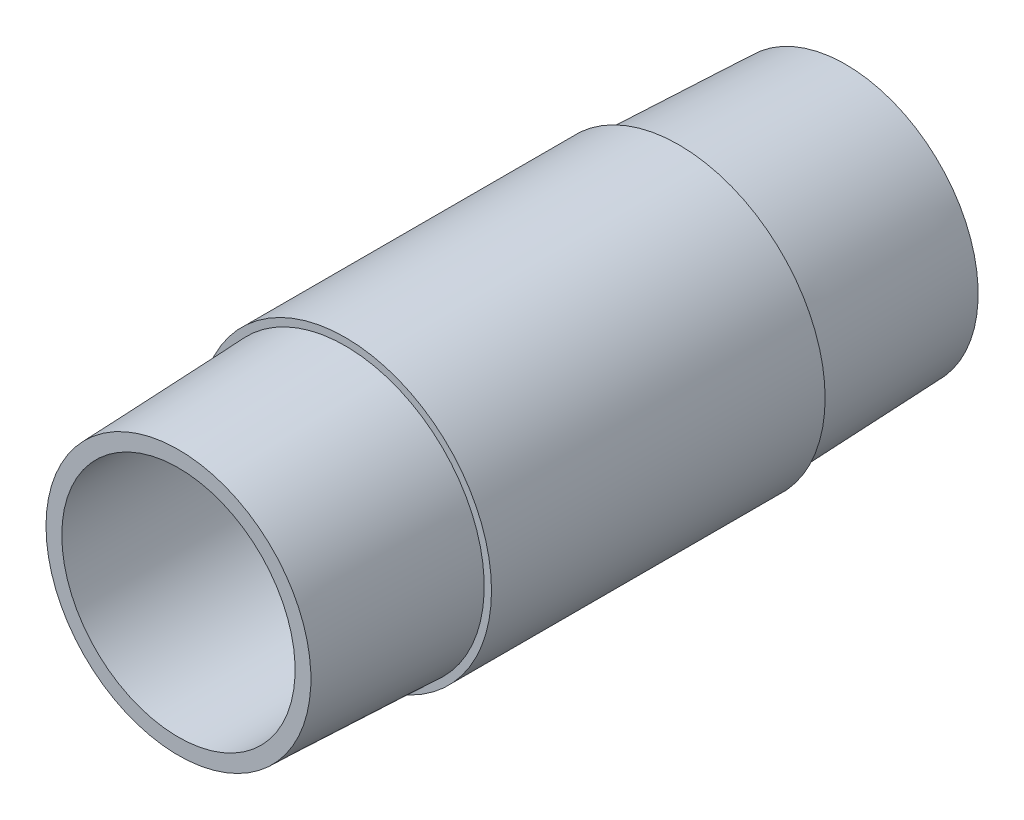
from build123d import *

# Parameters (mm, degrees)
SKETCH2_R           = 16.7005
SKETCH2_R_2         = 13.3223
BOSS_EXTRUDE1_DEPTH = 76.2


with BuildPart() as part:
    # Sketch2 → Boss-Extrude1 (new body)
    with BuildSketch(Plane.XY):
        with Locations(Location((0, 0, 0), (0, 0, 180))):
            Circle(SKETCH2_R)
        with Locations(Location((0, 0, 0), (0, 0, 180))):
            Circle(SKETCH2_R_2, mode=Mode.SUBTRACT)
    extrude(amount=BOSS_EXTRUDE1_DEPTH)

    # Sketch3 → Cut-Revolve2 (revolve, cut)
    with BuildSketch(Plane(origin=(0, 0, 0), x_dir=(0, 0, -1), z_dir=(1, 0, 0)), mode=Mode.PRIVATE) as cut_revolve2_sk:
        Polygon((0, 21.813584822), (-19.05, 21.813584822), (-19.05, 16.7005), (-19.05, 15.869250272), (0, 15.126208453), align=None)
        Polygon((-76.2, 15.126208453), (-76.2, 21.813584822), (-57.15, 21.813584822), (-57.15, 16.7005), (-57.15, 15.869250272), align=None)
    revolve(cut_revolve2_sk.sketch.rotate(Axis((0, 0, 38.1), (0, 0, 1)), 90), axis=Axis((0, 0, 38.1), (0, 0, 1)), mode=Mode.SUBTRACT)


solid = part.part
